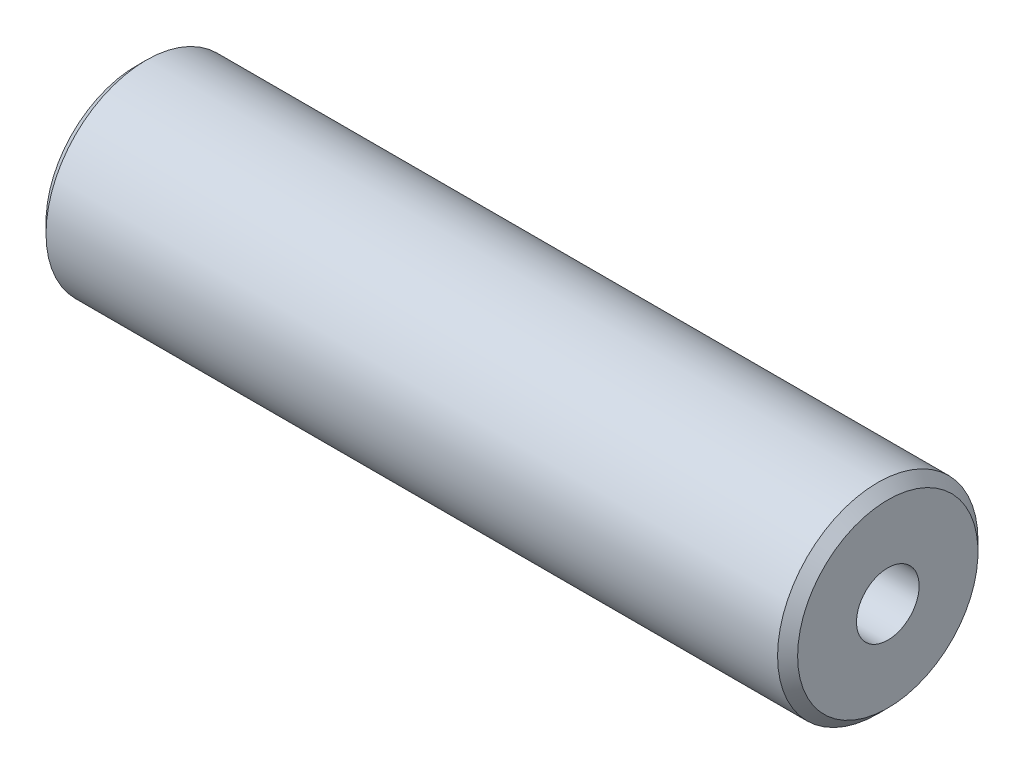
from build123d import *

# Parameters (mm, degrees)
SKETCH1_W           = 30
SKETCH1_H           = 4
CHAMFER1_SIZE       = 0.4
TAPPED_HOLE10_D     = 2.5
TAPPED_HOLE10_DEPTH = 8.5
TAPPED_HOLE10_TIP   = 0.751075774
TAPPED_HOLE11_D     = 2.5
TAPPED_HOLE11_DEPTH = 8.5
TAPPED_HOLE11_TIP   = 0.751075774


with BuildPart() as part:
    # Sketch1 → Revolve1 (revolve)
    with BuildSketch(Plane.XY, mode=Mode.PRIVATE) as revolve1_sk:
        with Locations((15, 2)):
            Rectangle(SKETCH1_W, SKETCH1_H)
    revolve(revolve1_sk.sketch.rotate(Axis((0, 0, 0), (1, 0, 0)), 90), axis=Axis((0, 0, 0), (1, 0, 0)))

    # Chamfer1
    chamfer1_edges = [part.edges().sort_by_distance(p)[0] for p in [
        (0, 0, -4),
        (30, 0, -4),
    ]]
    chamfer(chamfer1_edges, length=CHAMFER1_SIZE)

    # Tapped Hole10
    with Locations(Plane.ZY):
        with Locations((0, 0)):
            Hole(TAPPED_HOLE10_D / 2, depth=TAPPED_HOLE10_DEPTH)
            with Locations((0, 0, -(TAPPED_HOLE10_DEPTH + TAPPED_HOLE10_TIP / 2))):  # 118° drill point
                Cone(0, TAPPED_HOLE10_D / 2, TAPPED_HOLE10_TIP, mode=Mode.SUBTRACT)

    # Tapped Hole11
    with Locations(Plane(origin=(30, 0, 0), x_dir=(0, 0, -1), z_dir=(1, 0, 0))):
        with Locations((0, 0)):
            Hole(TAPPED_HOLE11_D / 2, depth=TAPPED_HOLE11_DEPTH)
            with Locations((0, 0, -(TAPPED_HOLE11_DEPTH + TAPPED_HOLE11_TIP / 2))):  # 118° drill point
                Cone(0, TAPPED_HOLE11_D / 2, TAPPED_HOLE11_TIP, mode=Mode.SUBTRACT)


solid = part.part
